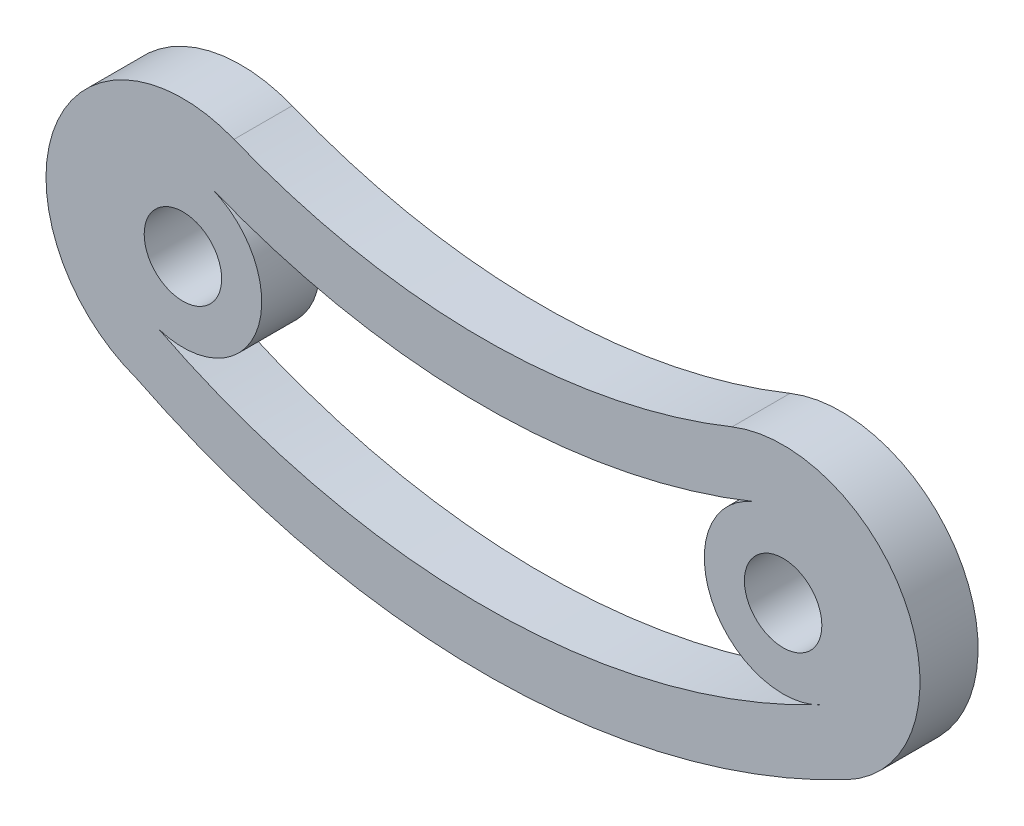
from build123d import *

# Parameters (mm, degrees)
SKETCH1_R           = 1.5
EXTRUDE1_DEPTH      = 3
BOSS_EXTRUDE2_START = -3
BOSS_EXTRUDE2_DEPTH = 3
CUT_EXTRUDE4_START  = -5
CUT_EXTRUDE4_DEPTH  = 5
BOSS_EXTRUDE3_DEPTH = 3
BOSS_EXTRUDE4_DEPTH = 3
SKETCH7_R           = 2
CUT_EXTRUDE6_DEPTH  = 5


with BuildPart() as part:
    # Sketch1 → Extrude1 (new body)
    with BuildSketch(Plane.XY):
        with BuildLine():
            ThreePointArc((0, 5), (-5, 0), (0, -5))
            Line((0, -5), (31, -5))
            ThreePointArc((31, -5), (36, 0), (31, 5))
            Line((31, 5), (0, 5))
        make_face()
        Circle(SKETCH1_R, mode=Mode.SUBTRACT)
        with BuildLine():
            ThreePointArc((32.5, 0), (31, -1.5), (29.5, 0))
            ThreePointArc((29.5, 0), (31, 1.5), (32.5, 0))
        make_face(mode=Mode.SUBTRACT)
    extrude(amount=EXTRUDE1_DEPTH)

    # Sketch2 → Boss-Extrude2 (add)
    with BuildSketch(Plane.XY.offset(3).offset(BOSS_EXTRUDE2_START)):
        with BuildLine():
            Line((30.833786225, -5), (0.166213775, -5))
            ThreePointArc((0.166213775, -5), (15.5, -10), (30.833786225, -5))
        make_face()
        with BuildLine():
            ThreePointArc((36, 0), (36, 5), (31, 5))
            ThreePointArc((31, 5), (34.535533906, 3.535533906), (36, 0))
        make_face()
        with BuildLine():
            ThreePointArc((-5, 0), (-3.535533906, 3.535533906), (0, 5))
            ThreePointArc((0, 5), (-5, 5), (-5, 0))
        make_face()
    extrude(amount=BOSS_EXTRUDE2_DEPTH)

    # Sketch2<6> → Cut-Extrude4 (cut)
    with BuildSketch(Plane.XY.offset(3).offset(CUT_EXTRUDE4_START)):
        with BuildLine():
            Line((31, 5), (0, 5))
            ThreePointArc((0, 5), (15.5, -1.27314911), (31, 5))
        make_face()
        with BuildLine():
            ThreePointArc((31, -5), (34.535533906, -3.535533906), (36, 0))
            ThreePointArc((36, 0), (33.590468728, -2.679345747), (30.833786225, -5))
            Line((30.833786225, -5), (31, -5))
        make_face()
        with BuildLine():
            ThreePointArc((0.166213775, -5), (-2.590468728, -2.679345747), (-5, 0))
            ThreePointArc((-5, 0), (-3.535533906, -3.535533906), (0, -5))
            Line((0, -5), (0.166213775, -5))
        make_face()
    extrude(amount=CUT_EXTRUDE4_DEPTH, mode=Mode.SUBTRACT)

    # Sketch5 → Boss-Extrude3 (add)
    with BuildSketch(Plane(origin=(0, 0, 0), x_dir=(-1, 0, 0), z_dir=(0, 0, -1))):
        with BuildLine():
            ThreePointArc((-2.599706958, -6.575828749), (5.911032444, -3.880682343), (4.999999984, 5.000000016))
            ThreePointArc((4.999999984, 5.000000016), (6.035533906, 2.500000011), (5, 0))
            ThreePointArc((5, 0), (1.520730735, -3.658414607), (-2.599706958, -6.575828749))
        make_face()
        with BuildLine():
            ThreePointArc((0, 5), (2.499999989, 6.035533906), (4.999999984, 5.000000016))
            ThreePointArc((4.999999984, 5.000000016), (-2.526282139, 6.604384797), (-7.06048758, 0.386671862))
            ThreePointArc((-7.06048758, 0.386671862), (-3.310013829, 2.356284055), (0, 5))
        make_face()
        with BuildLine():
            ThreePointArc((-36.000000042, 4.999999958), (-36.911032421, -3.880682377), (-28.400293042, -6.575828749))
            ThreePointArc((-28.400293042, -6.575828749), (-32.520730735, -3.658414607), (-36, 0))
            ThreePointArc((-36, 0), (-37.035533906, 2.499999971), (-36.000000042, 4.999999958))
        make_face()
        with BuildLine():
            ThreePointArc((-31, 5), (-27.689986171, 2.356284055), (-23.93951242, 0.386671862))
            ThreePointArc((-23.93951242, 0.386671862), (-28.473717899, 6.604384812), (-36.000000042, 4.999999958))
            ThreePointArc((-36.000000042, 4.999999958), (-33.500000029, 6.035533906), (-31, 5))
        make_face()
    extrude(amount=-BOSS_EXTRUDE3_DEPTH)

    # Sketch6 → Boss-Extrude4 (add)
    with BuildSketch(Plane(origin=(0, 0, 0), x_dir=(-1, 0, 0), z_dir=(0, 0, -1))):
        with BuildLine():
            ThreePointArc((-7.06048758, 0.386671862), (-5.748903613, 4.117050795), (-2.639524867, 6.559947292))
            ThreePointArc((-2.639524867, 6.559947292), (-15.5, 4.069630639), (-28.360475133, 6.559947292))
            ThreePointArc((-28.360475133, 6.559947292), (-25.251096387, 4.117050795), (-23.93951242, 0.386671862))
            ThreePointArc((-23.93951242, 0.386671862), (-15.5, -1.27314911), (-7.06048758, 0.386671862))
        make_face()
        with BuildLine():
            ThreePointArc((-34.288674296, -6.259762086), (-15.993644495, -10.877173454), (2.396097668, -6.652722448))
            ThreePointArc((2.396097668, -6.652722448), (-0.108822543, -7.070230382), (-2.599706958, -6.575828749))
            ThreePointArc((-2.599706958, -6.575828749), (-15.5, -10), (-28.400293042, -6.575828749))
            ThreePointArc((-28.400293042, -6.575828749), (-31.379003341, -7.060903375), (-34.288674296, -6.259762086))
        make_face()
    extrude(amount=-BOSS_EXTRUDE4_DEPTH)

    # Sketch7 → Cut-Extrude6 (cut)
    with BuildSketch(Plane(origin=(0, 0, 0), x_dir=(-1, 0, 0), z_dir=(0, 0, -1))):
        Circle(SKETCH7_R)
        with Locations((-31, 0)):
            Circle(SKETCH7_R)
        with BuildLine():
            ThreePointArc((-29.480330692, 3.776797363), (-27.304888135, -1.70872509), (-32.893407958, -3.603969954))
            ThreePointArc((-32.893407958, -3.603969954), (-15.863554262, -7.878266077), (1.233165938, -3.879806039))
            ThreePointArc((1.233165938, -3.879806039), (-3.83098094, -1.377380909), (-1.519669308, 3.776797363))
            ThreePointArc((-1.519669308, 3.776797363), (-15.5, 1.069630639), (-29.480330692, 3.776797363))
        make_face()
    extrude(amount=-CUT_EXTRUDE6_DEPTH, mode=Mode.SUBTRACT)


solid = part.part
